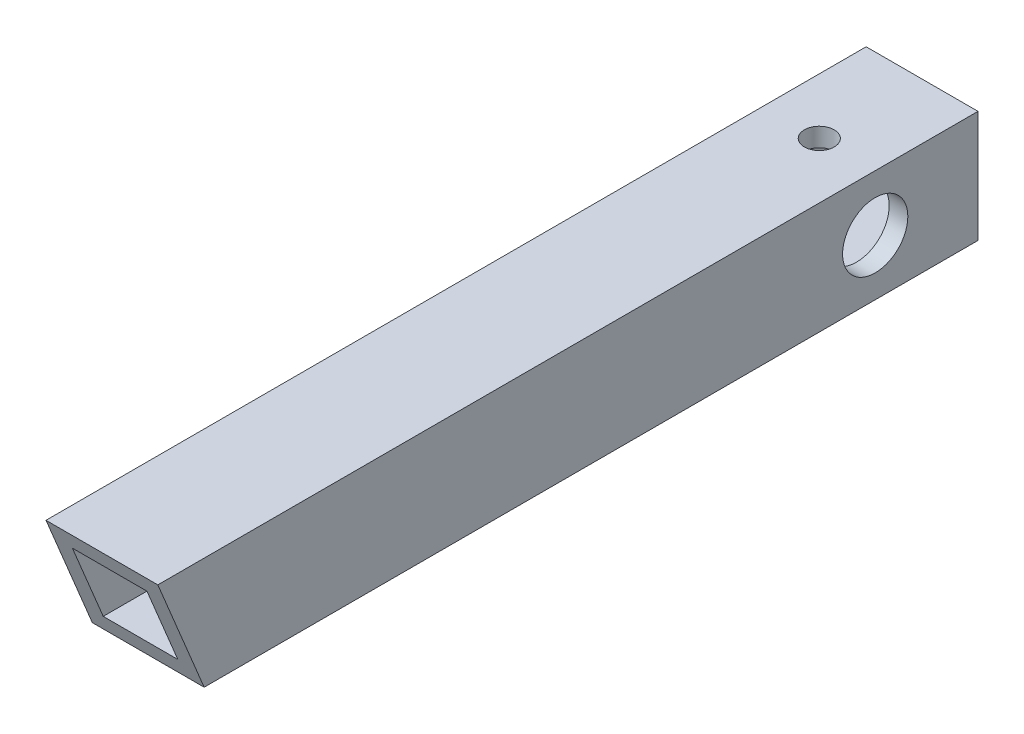
from build123d import *

# Parameters (mm, degrees)
SKETCH1_W           = 19.05
SKETCH1_H           = 19.05
SKETCH1_W_2         = 12.7
SKETCH1_H_2         = 12.7
BOSS_EXTRUDE1_DEPTH = 69.85
CUT_EXTRUDE1_DEPTH  = 74.025
SKETCH3_R           = 5.55625
CUT_EXTRUDE2_DEPTH  = 74.025
SKETCH4_R           = 2.54
CUT_EXTRUDE3_DEPTH  = 74.025


with BuildPart() as part:
    # Sketch1 → Boss-Extrude1 (new, symmetric)
    with BuildSketch(Plane.XY):
        Rectangle(SKETCH1_W, SKETCH1_H)
        Rectangle(SKETCH1_W_2, SKETCH1_H_2, mode=Mode.SUBTRACT)
    extrude(amount=BOSS_EXTRUDE1_DEPTH, both=True)

    # Sketch2 → Cut-Extrude1 (cut, through all)
    with BuildSketch(Plane(origin=(9.525, 0, 0), x_dir=(0, 0, -1), z_dir=(1, 0, 0))):
        Polygon((-69.85, 9.525), (-61.959231637, -9.525), (-69.85, -9.525), align=None)
    extrude(amount=-CUT_EXTRUDE1_DEPTH, mode=Mode.SUBTRACT)

    # Sketch3 → Cut-Extrude2 (cut, through all)
    with BuildSketch(Plane(origin=(9.525, 0, 0), x_dir=(0, 0, -1), z_dir=(1, 0, 0))):
        with Locations((52.340768363, 0)):
            Circle(SKETCH3_R)
    extrude(amount=-CUT_EXTRUDE2_DEPTH, mode=Mode.SUBTRACT)

    # Sketch4 → Cut-Extrude3 (cut, through all)
    with BuildSketch(Plane(origin=(0, 9.525, 0), x_dir=(1, 0, 0), z_dir=(0, 1, 0))):
        with Locations(Location((0, 52.340768363, 0), (0, 0, 270))):
            Circle(SKETCH4_R)
    extrude(amount=-CUT_EXTRUDE3_DEPTH, mode=Mode.SUBTRACT)


solid = part.part
